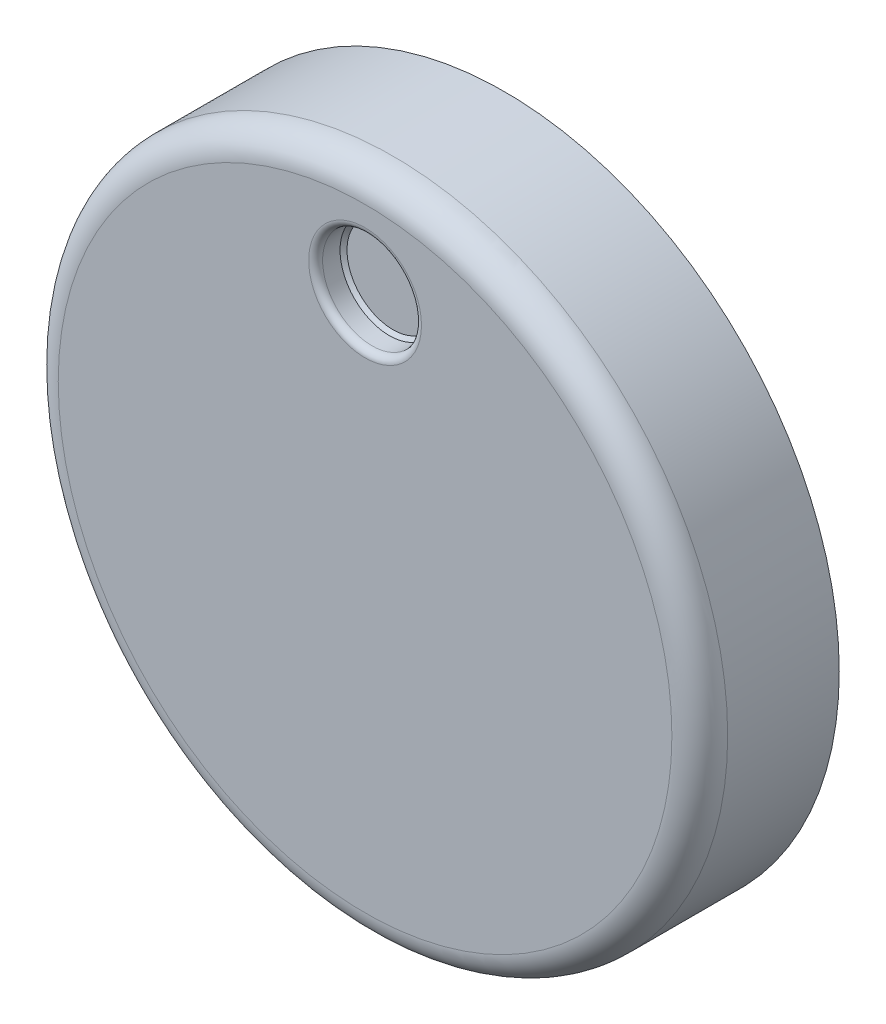
from build123d import *

# Parameters (mm, degrees)
SKETCH1_R           = 48
BOSS_EXTRUDE1_DEPTH = 20
FILLET1_R           = 4
SKETCH2_R           = 7.089026355
CUT_EXTRUDE1_DEPTH  = 4
FILLET3_R           = 1
CHAMFER1_SIZE       = 0.5


with BuildPart() as part:
    # Sketch1 → Boss-Extrude1 (new body)
    with BuildSketch(Plane.XY):
        Circle(SKETCH1_R)
    extrude(amount=-BOSS_EXTRUDE1_DEPTH)

    # Fillet1
    fillet1_edges = [part.edges().sort_by_distance(p)[0] for p in [
        (-48, 0, 0),
    ]]
    fillet(fillet1_edges, radius=FILLET1_R)

    # Sketch2 → Cut-Extrude1 (cut)
    with BuildSketch(Plane.XY):
        with Locations((0, 33.015746337)):
            Circle(SKETCH2_R)
    extrude(amount=-CUT_EXTRUDE1_DEPTH, mode=Mode.SUBTRACT)

    # Fillet3
    fillet3_edges = [part.edges().sort_by_distance(p)[0] for p in [
        (-7.089026355, 33.015746337, 0),
    ]]
    fillet(fillet3_edges, radius=FILLET3_R)

    # Chamfer1
    chamfer1_edges = [part.edges().sort_by_distance(p)[0] for p in [
        (-7.089026355, 33.015746337, -4),
    ]]
    chamfer(chamfer1_edges, length=CHAMFER1_SIZE)


solid = part.part
